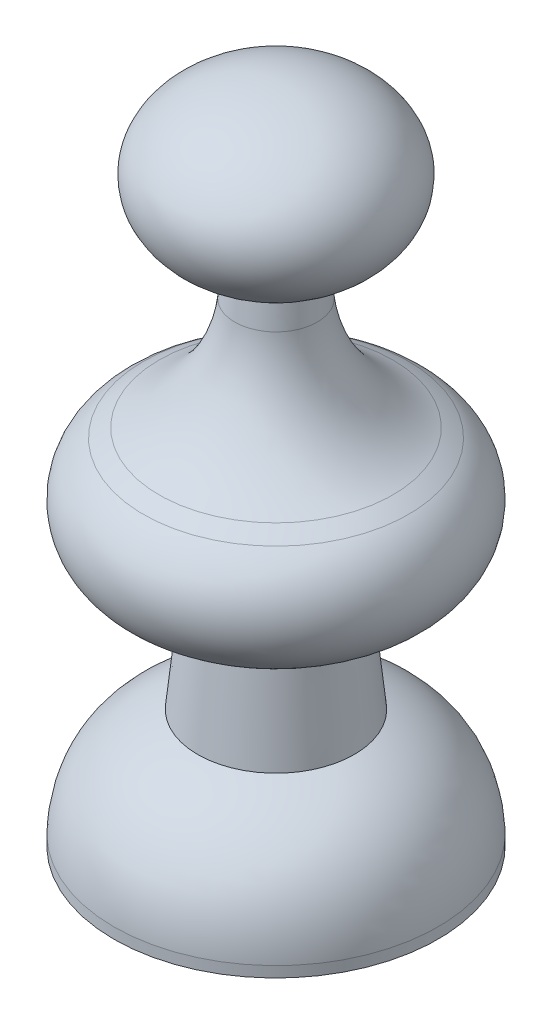
from build123d import *

# Parameters (mm, degrees)
FILLET1_R           = 10.16
SKETCH2_R           = 11.5
BOSS_EXTRUDE1_DEPTH = 0.762


with BuildPart() as part:
    # Sketch1 → Revolve2 (revolve)
    with BuildSketch(Plane.XY):
        with BuildLine():
            Line((0, 0), (-11.5, 0))
            add(Edge.make_bspline(
                [(-11.5, 0), (-11.220739293, 5.544803256), (-5.55625, 7.617272324)],
                knots=[0, 0, 0, 1, 1, 1], degree=2))
            Line((-5.55625, 7.617272324), (-4.901669939, 13.903490338))
            ThreePointArc((-4.901669939, 13.903490338), (-5.164319432, 14.928612706), (-6.031194019, 15.535563344))
            ThreePointArc((-6.031194019, 15.535563344), (-7.369332515, 15.928432597), (-8.682156627, 16.399021311))
            ThreePointArc((-8.682156627, 16.399021311), (-11.481263588, 20.122495295), (-9.410127559, 24.294983023))
            ThreePointArc((-9.410127559, 24.294983023), (-6.597205673, 25.719036341), (-3.577073686, 26.624166263))
            Line((-3.577073686, 26.624166263), (-2.678769267, 35.250975656))
            add(Edge.make_bspline(
                [(0, 46.0375), (-6.676683754, 46.0375), (-7.820213597, 41.432880768), (-8.96374344, 36.828261536), (-2.678769267, 35.250975656)],
                knots=[1.570796327, 1.570796327, 1.570796327, 2.969471921, 2.969471921, 4.368147514, 4.368147514, 4.368147514], degree=2, weights=[1, 0.765268623, 1, 0.765268623, 1]))
            Line((0, 46.0375), (0, 0))
        make_face()
    revolve(axis=Axis((0, 46.0375, 0), (0, -1, 0)))

    # Fillet1
    fillet1_edges = [part.edges().sort_by_distance(p)[0] for p in [
        (3.577073686, 26.624166263, 0),
    ]]
    fillet(fillet1_edges, radius=FILLET1_R)


with BuildPart() as body_2:
    # Sketch2 → Boss-Extrude1 (new body)
    with BuildSketch(Plane.XZ):
        with Locations(Location((0, 0, 0), (0, 0, 90))):
            Circle(SKETCH2_R)
    extrude(amount=BOSS_EXTRUDE1_DEPTH)


solid = Compound([part.part, body_2.part])
